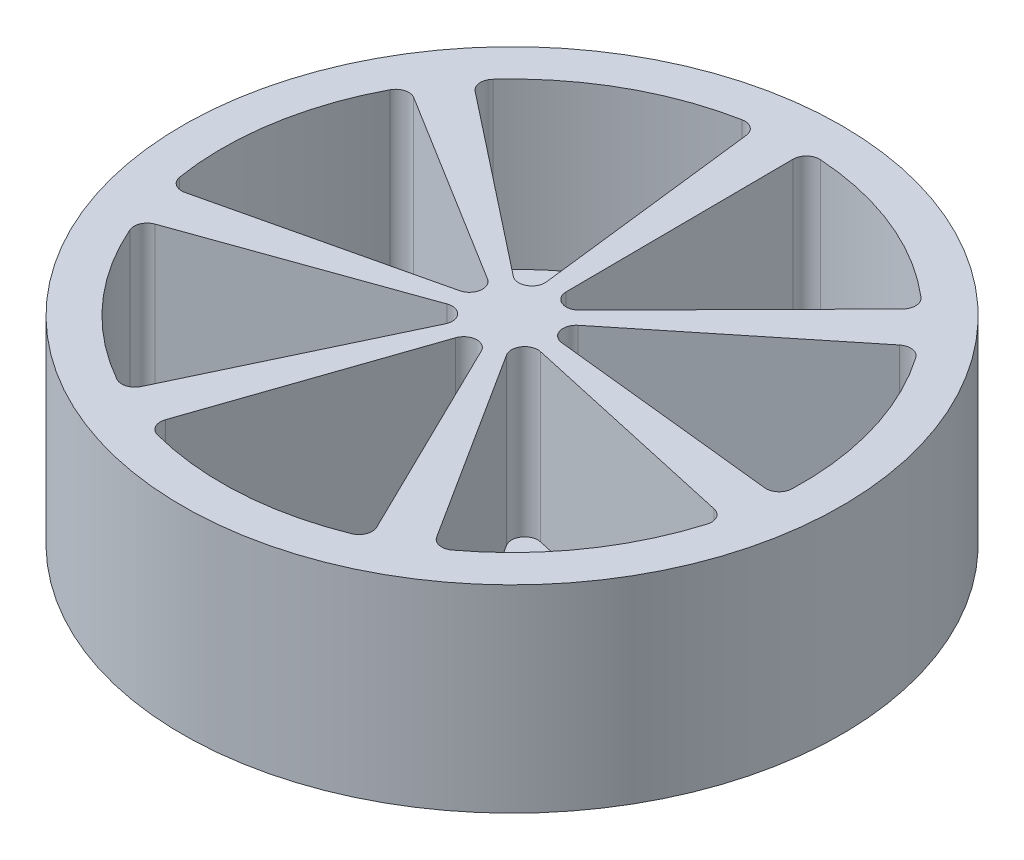
from build123d import *

# Parameters (mm, degrees)
SKETCH1_R           = 63.5
BOSS_EXTRUDE1_DEPTH = 38.1
CUT_EXTRUDE2_DEPTH  = 31.75


with BuildPart() as part:
    # Sketch1 → Boss-Extrude1 (new body)
    with BuildSketch(Plane(origin=(0, 0, 0), x_dir=(1, 0, 0), z_dir=(0, 1, 0))):
        with Locations(Location((0, 0, 0), (0, 0, 90))):
            Circle(SKETCH1_R)
    extrude(amount=BOSS_EXTRUDE1_DEPTH)

    # Sketch2 → Cut-Extrude2 (cut)
    with BuildSketch(Plane(origin=(0, 38.1, 0), x_dir=(1, 0, 0), z_dir=(0, 1, 0))):
        with BuildLine():
            Line((-1.7819572, -9.111319007), (-16.057301334, -50.738697991))
            ThreePointArc((-16.057301334, -50.738697991), (-15.89484722, -52.75977688), (-14.304875125, -54.018005773))
            ThreePointArc((-14.304875125, -54.018005773), (3.484226214, -55.771270092), (20.916794468, -51.817584942))
            ThreePointArc((20.916794468, -51.817584942), (22.337802979, -50.371249564), (22.247447967, -48.345666393))
            Line((22.247447967, -48.345666393), (2.902107489, -8.818689111))
            ThreePointArc((2.902107489, -8.818689111), (0.462316687, -7.400205158), (-1.7819572, -9.111319007))
        make_face()
        with BuildLine():
            Line((8.704163204, -3.229403726), (51.669220951, -12.749274735))
            ThreePointArc((51.669220951, -12.749274735), (53.309221074, -13.941562792), (53.554027291, -15.954327341))
            ThreePointArc((53.554027291, -15.954327341), (45.776114287, -32.048740393), (33.314033776, -44.863677441))
            ThreePointArc((33.314033776, -44.863677441), (31.338979429, -45.322274799), (29.657547842, -44.189164464))
            Line((29.657547842, -44.189164464), (6.012483905, -7.074004722))
            ThreePointArc((6.012483905, -7.074004722), (6.073963109, -4.252498707), (8.704163204, -3.229403726))
        make_face()
        with BuildLine():
            Line((7.951806494, 4.791688532), (42.1830167, 32.447580836))
            ThreePointArc((42.1830167, 32.447580836), (44.13770839, 32.986405118), (45.863985261, 31.922864157))
            ThreePointArc((45.863985261, 31.922864157), (53.597654639, 15.807144497), (55.846795761, -1.926084944))
            ThreePointArc((55.846795761, -1.926084944), (54.973915369, -3.756175388), (53.039658589, -4.3642888))
            Line((53.039658589, -4.3642888), (9.279401997, 0.290179402))
            ThreePointArc((9.279401997, 0.290179402), (7.111791423, 2.097426005), (7.951806494, 4.791688532))
        make_face()
        with BuildLine():
            Line((1.211577307, 9.204541593), (0.932140496, 53.210746228))
            ThreePointArc((0.932140496, 53.210746228), (1.729601044, 55.074937175), (3.637426875, 55.761487836))
            ThreePointArc((3.637426875, 55.761487836), (21.059067856, 51.759927174), (36.325781471, 42.461888801))
            ThreePointArc((36.325781471, 42.461888801), (37.212371773, 40.638400701), (36.481824607, 38.746985345))
            Line((36.481824607, 38.746985345), (5.55874112, 7.435852518))
            ThreePointArc((5.55874112, 7.435852518), (2.794295742, 6.867946156), (1.211577307, 9.204541593))
        make_face()
        with BuildLine():
            Line((-6.440994304, 6.686187096), (-41.020656513, 33.905134408))
            ThreePointArc((-41.020656513, 33.905134408), (-41.980931166, 35.690918215), (-41.328188139, 37.610573848))
            ThreePointArc((-41.328188139, 37.610573848), (-27.33742655, 48.736428979), (-10.549287178, 54.875194214))
            ThreePointArc((-10.549287178, 54.875194214), (-8.570846762, 54.431432191), (-7.547567398, 52.680989231))
            Line((-7.547567398, 52.680989231), (-2.347765198, 8.982177024))
            ThreePointArc((-2.347765198, 8.982177024), (-3.627361626, 6.466762771), (-6.440994304, 6.686187096))
        make_face()
        with BuildLine():
            Line((-9.243365832, -0.867002658), (-52.084062499, -10.931735159))
            ThreePointArc((-52.084062499, -10.931735159), (-54.078965953, -10.569090123), (-55.172834542, -8.861869364))
            ThreePointArc((-55.172834542, -8.861869364), (-55.148281182, 9.013405721), (-49.480527415, 25.966359134))
            ThreePointArc((-49.480527415, 25.966359134), (-47.900042872, 27.236485042), (-45.89348721, 26.94513373))
            Line((-45.89348721, 26.94513373), (-8.486356436, 3.764739028))
            ThreePointArc((-8.486356436, 3.764739028), (-7.317541705, 1.195975121), (-9.243365832, -0.867002658))
        make_face()
        with BuildLine():
            Line((-5.085294358, -7.767321727), (-23.927107102, -47.536785185))
            ThreePointArc((-23.927107102, -47.536785185), (-25.454436367, -48.870358028), (-27.471211214, -48.661144195))
            ThreePointArc((-27.471211214, -48.661144195), (-41.431355264, -37.496895885), (-51.15192129, -22.495673991))
            ThreePointArc((-51.15192129, -22.495673991), (-51.159529717, -20.468090867), (-49.680675096, -19.080957051))
            Line((-49.680675096, -19.080957051), (-8.234548188, -4.287624243))
            ThreePointArc((-8.234548188, -4.287624243), (-5.49746363, -4.975406188), (-5.085294358, -7.767321727))
        make_face()
    extrude(amount=-CUT_EXTRUDE2_DEPTH, mode=Mode.SUBTRACT)


solid = part.part
